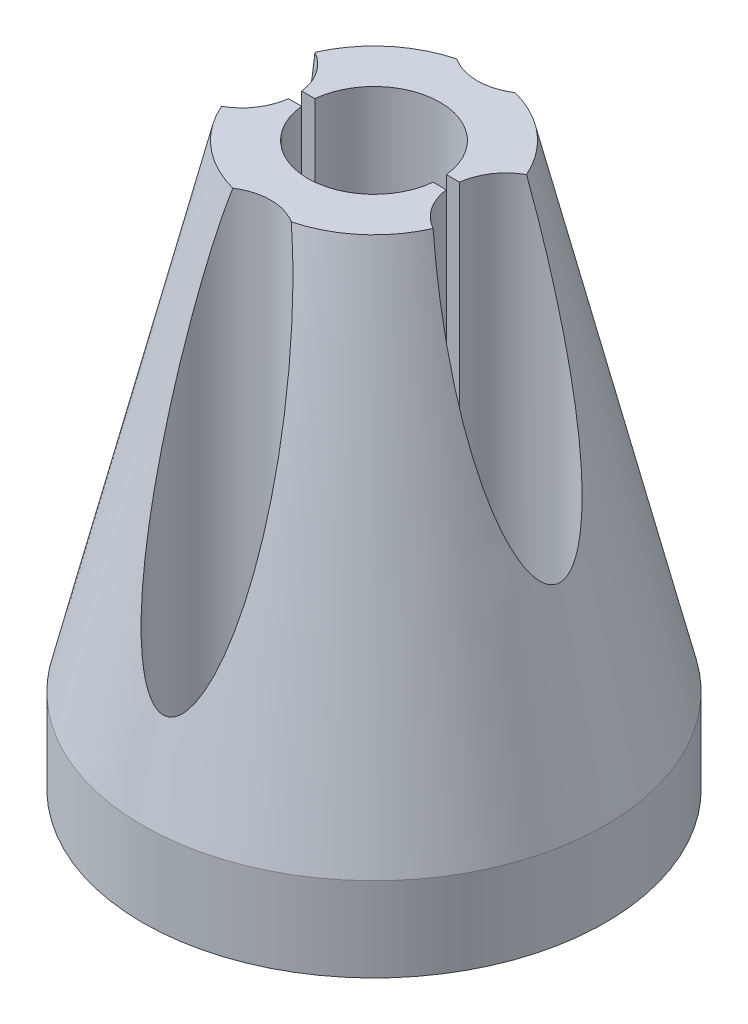
from build123d import *

# Parameters (mm, degrees)
SKETCH_2_R          = 1.6
CUT_EXTRUDE_1_DEPTH = 36.114099732
SKETCH_5_R          = 4
SKETCH_5_R_2        = 3.326438837
EXTRUDE_1_DEPTH     = 0.3
EXTRUDE_START       = 5
SKETCH_6_R          = 14
SKETCH_6_R_2        = 3.326438837
SKETCH_6_R_3        = 1.6
EXTRUDE_2_DEPTH     = 5
CUT_EXTRUDE_START   = 1
SKETCH_3_R          = 3.25
CUT_EXTRUDE_5_DEPTH = 37.114099894
CUT_EXTRUDE_START_2 = -4
SKETCH_7_R          = 4
SKETCH_7_R_2        = 3.326438837
CUT_EXTRUDE_6_DEPTH = 4
SKETCH_8_W          = 12
SKETCH_8_H          = 0.8
CUT_EXTRUDE_7_DEPTH = 30


with BuildPart() as part:
    # 草图1 → 旋转1 (revolve)
    with BuildSketch(Plane.XY, mode=Mode.PRIVATE) as revolve_1_sk:
        Polygon((4, 29), (4, 0), (14, 0), (14, 0.1), (7, 29), align=None)
    revolve(revolve_1_sk.sketch.rotate(Axis((0, 0, 0), (0, 1, 0)), 90), axis=Axis((0, 0, 0), (0, 1, 0)))

    # 草图2 → 切除-拉伸1 (cut, through all)
    with BuildSketch(Plane.XZ):
        with Locations(Location((8, 0, 0), (0, 0, 270))):
            Circle(SKETCH_2_R)
        with Locations(Location((0, 9.5, 0), (0, 0, 270))):
            Circle(SKETCH_2_R)
        with Locations(Location((0, -9.5, 0), (0, 0, 270))):
            Circle(SKETCH_2_R)
        with Locations(Location((-8, 0, 0), (0, 0, 270))):
            Circle(SKETCH_2_R)
    extrude(amount=-CUT_EXTRUDE_1_DEPTH, mode=Mode.SUBTRACT)

    # 草图5 → 凸台-拉伸1 (add)
    with BuildSketch(Plane.XZ):
        with Locations(Location((0, 0, 0), (0, 0, 270))):
            Circle(SKETCH_5_R)
        with Locations(Location((0, 0, 0), (0, 0, 270))):
            Circle(SKETCH_5_R_2, mode=Mode.SUBTRACT)
    extrude(amount=-EXTRUDE_1_DEPTH)

    # 草图6 → 凸台-拉伸2 (add)
    with BuildSketch(Plane.XZ.offset(EXTRUDE_START)):
        with Locations(Location((0, 0, 0), (0, 0, 270))):
            Circle(SKETCH_6_R)
        with Locations(Location((0, 0, 0), (0, 0, 270))):
            Circle(SKETCH_6_R_2, mode=Mode.SUBTRACT)
        with Locations(Location((0, 9.5, 0), (0, 0, 270))):
            Circle(SKETCH_6_R_3, mode=Mode.SUBTRACT)
        with Locations(Location((-8, 0, 0), (0, 0, 270))):
            Circle(SKETCH_6_R_3, mode=Mode.SUBTRACT)
        with Locations(Location((8, 0, 0), (0, 0, 270))):
            Circle(SKETCH_6_R_3, mode=Mode.SUBTRACT)
        with Locations(Location((0, -9.5, 0), (0, 0, 270))):
            Circle(SKETCH_6_R_3, mode=Mode.SUBTRACT)
    extrude(amount=-EXTRUDE_2_DEPTH)

    # 草图3 → 切除-拉伸5 (cut, through all)
    with BuildSketch(Plane.XZ.offset(CUT_EXTRUDE_START)):
        with Locations(Location((0, 9.5, 0), (0, 0, 270))):
            Circle(SKETCH_3_R)
        with Locations(Location((8, 0, 0), (0, 0, 270))):
            Circle(SKETCH_3_R)
        with Locations(Location((0, -9.5, 0), (0, 0, 270))):
            Circle(SKETCH_3_R)
        with Locations(Location((-8, 0, 0), (0, 0, 270))):
            Circle(SKETCH_3_R)
    extrude(amount=-CUT_EXTRUDE_5_DEPTH, mode=Mode.SUBTRACT)

    # 草图7 → 切除-拉伸6 (cut)
    with BuildSketch(Plane(origin=(0, 0.3, 0), x_dir=(1, 0, 0), z_dir=(0, 1, 0)).offset(CUT_EXTRUDE_START_2)):
        with Locations(Location((0, 0, 0), (0, 0, 90))):
            Circle(SKETCH_7_R)
        with Locations(Location((0, 0, 0), (0, 0, 90))):
            Circle(SKETCH_7_R_2, mode=Mode.SUBTRACT)
    extrude(amount=CUT_EXTRUDE_6_DEPTH, mode=Mode.SUBTRACT)

    # 草图8 → 切除-拉伸7 (cut)
    with BuildSketch(Plane(origin=(0, 29, 0), x_dir=(1, 0, 0), z_dir=(0, 1, 0))):
        Rectangle(SKETCH_8_W, SKETCH_8_H)
    extrude(amount=-CUT_EXTRUDE_7_DEPTH, mode=Mode.SUBTRACT)


solid = part.part
